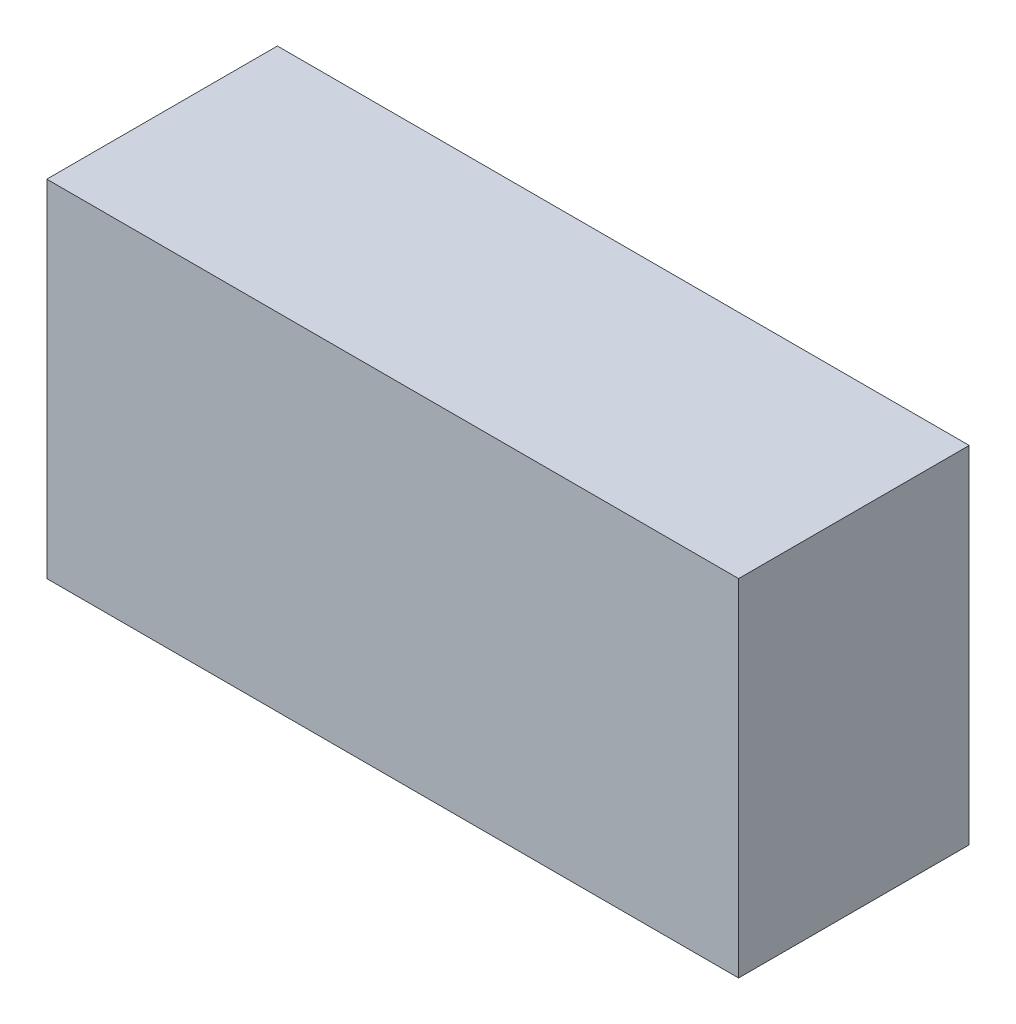
from build123d import *

# Parameters (mm, degrees)
SKETCH1_W           = 152.4
SKETCH1_H           = 76.2
BOSS_EXTRUDE1_DEPTH = 50.8


with BuildPart() as part:
    # Sketch1 → Boss-Extrude1 (new body)
    with BuildSketch(Plane.XY):
        with Locations((76.2, 38.1)):
            Rectangle(SKETCH1_W, SKETCH1_H)
    extrude(amount=BOSS_EXTRUDE1_DEPTH)


solid = part.part
